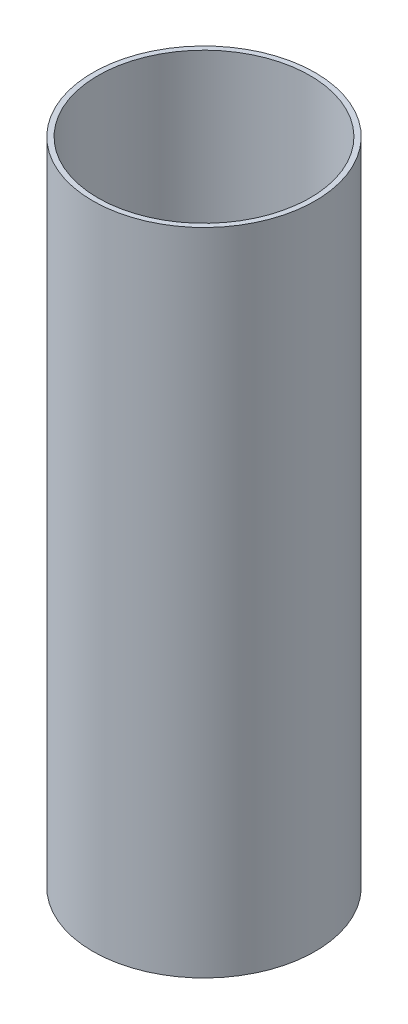
from build123d import *

# Parameters (mm, degrees)
ESQUISSE1_R        = 32.5
ESQUISSE1_R_2      = 31
BOSS_EXTRU_1_DEPTH = 190


with BuildPart() as part:
    # Esquisse1 → Boss.-Extru.1 (new body)
    with BuildSketch(Plane(origin=(0, 0, 0), x_dir=(1, 0, 0), z_dir=(0, 1, 0))):
        with Locations(Location((0, 0, 0), (0, 0, 270))):
            Circle(ESQUISSE1_R)
        with Locations(Location((0, 0, 0), (0, 0, 270))):
            Circle(ESQUISSE1_R_2, mode=Mode.SUBTRACT)
    extrude(amount=BOSS_EXTRU_1_DEPTH)


solid = part.part
